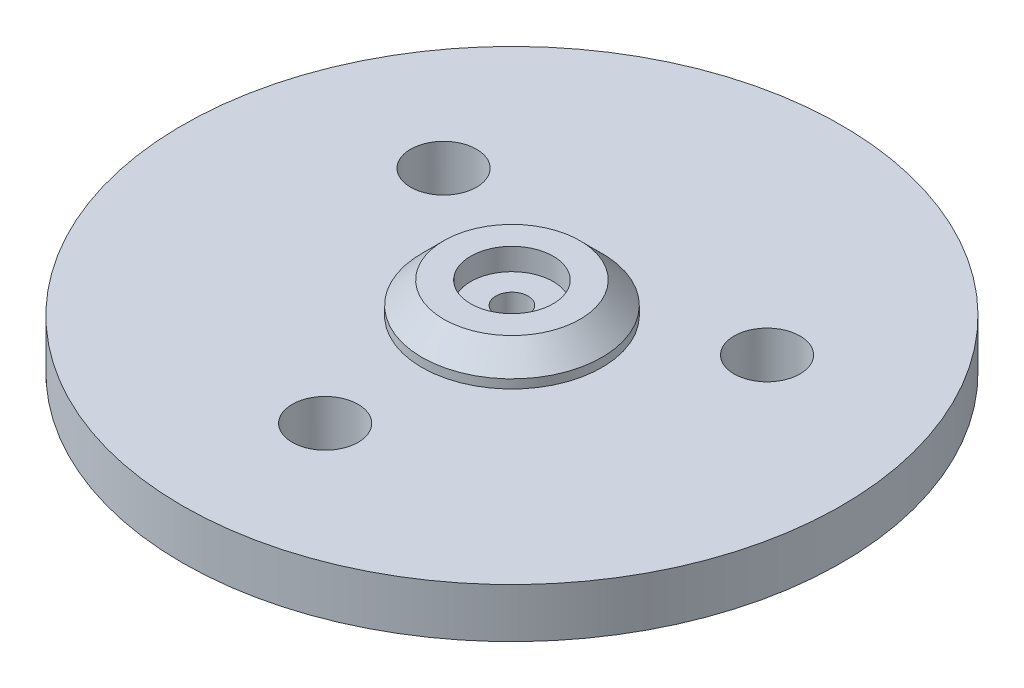
from build123d import *

# Parameters (mm, degrees)
SKETCH_1_R          = 15
EXTRUDE_1_DEPTH     = 2.25
SKETCH_2_R          = 4.1
EXTRUDE_2_DEPTH     = 1.4
CHAMFER_1_SIZE      = 1
SKETCH_3_R          = 6.65
EXTRUDE_3_DEPTH     = 3.3
CHAMFER_2_SIZE      = 2.9
CUT_EXTRUDE_2_DEPTH = 3
SKETCH_5_R          = 1.877591738
CUT_EXTRUDE_3_DEPTH = 1
SKETCH_6_R          = 0.7349705
CUT_EXTRUDE_4_DEPTH = 10
SKETCH_7_R          = 1.5
CUT_EXTRUDE_5_DEPTH = 10


with BuildPart() as part:
    # Эскиз1 → Бобышка-Вытянуть1 (new body)
    with BuildSketch(Plane(origin=(0, 0, 0), x_dir=(1, 0, 0), z_dir=(0, 1, 0))):
        with Locations(Location((0, 0, 0), (0, 0, 270))):
            Circle(SKETCH_1_R)
    extrude(amount=EXTRUDE_1_DEPTH)

    # Эскиз2 → Бобышка-Вытянуть2 (add)
    with BuildSketch(Plane(origin=(0, 2.25, 0), x_dir=(1, 0, 0), z_dir=(0, 1, 0))):
        with Locations(Location((0, 0, 0), (0, 0, 270))):
            Circle(SKETCH_2_R)
    extrude(amount=EXTRUDE_2_DEPTH)

    # Фаска1
    chamfer_1_edges = [part.edges().sort_by_distance(p)[0] for p in [
        (0, 3.65, -4.1),
    ]]
    chamfer(chamfer_1_edges, length=CHAMFER_1_SIZE)

    # Эскиз3 → Бобышка-Вытянуть3 (add)
    with BuildSketch(Plane.XZ):
        with Locations(Location((0, 0, 0), (0, 0, 90))):
            Circle(SKETCH_3_R)
    extrude(amount=EXTRUDE_3_DEPTH)

    # Фаска2
    chamfer_2_edges = [part.edges().sort_by_distance(p)[0] for p in [
        (0, -3.3, -6.65),
    ]]
    chamfer(chamfer_2_edges, length=CHAMFER_2_SIZE)

    # Эскиз4 → Вырез-Вытянуть2 (cut)
    with BuildSketch(Plane.XZ.offset(3.3)):
        Polygon((-0.805649398, 2.434445177), (-1.782131202, 1.843801142), (-2.405640065, 0.887969677), (-2.55268241, -0.243735072), (-2.194134697, -1.3271651), (-1.401011698, -2.147733805), (-0.33040115, -2.542917488), (0.805649398, -2.434445177), (1.782131202, -1.843801142), (2.405640065, -0.887969677), (2.55268241, 0.243735072), (2.194134697, 1.3271651), (1.401011698, 2.147733805), (0.33040115, 2.542917488), align=None)
    extrude(amount=-CUT_EXTRUDE_2_DEPTH, mode=Mode.SUBTRACT)

    # Эскиз5 → Вырез-Вытянуть3 (cut)
    with BuildSketch(Plane(origin=(0, 3.65, 0), x_dir=(1, 0, 0), z_dir=(0, 1, 0))):
        with Locations(Location((0, 0, 0), (0, 0, 270))):
            Circle(SKETCH_5_R)
    extrude(amount=-CUT_EXTRUDE_3_DEPTH, mode=Mode.SUBTRACT)

    # Эскиз6 → Вырез-Вытянуть4 (cut)
    with BuildSketch(Plane(origin=(0, 2.65, 0), x_dir=(1, 0, 0), z_dir=(0, 1, 0))):
        with Locations(Location((0, 0, 0), (0, 0, 270))):
            Circle(SKETCH_6_R)
    extrude(amount=-CUT_EXTRUDE_4_DEPTH, mode=Mode.SUBTRACT)

    # Эскиз7 → Вырез-Вытянуть5 (cut)
    with BuildSketch(Plane.XZ):
        with Locations(Location((-7.361215932, -4.25, 0), (0, 0, 270))):
            Circle(SKETCH_7_R)
        with Locations(Location((7.361215932, -4.25, 0), (0, 0, 270))):
            Circle(SKETCH_7_R)
        with Locations(Location((0, 8.5, 0), (0, 0, 270))):
            Circle(SKETCH_7_R)
    extrude(amount=-CUT_EXTRUDE_5_DEPTH, mode=Mode.SUBTRACT)


solid = part.part
